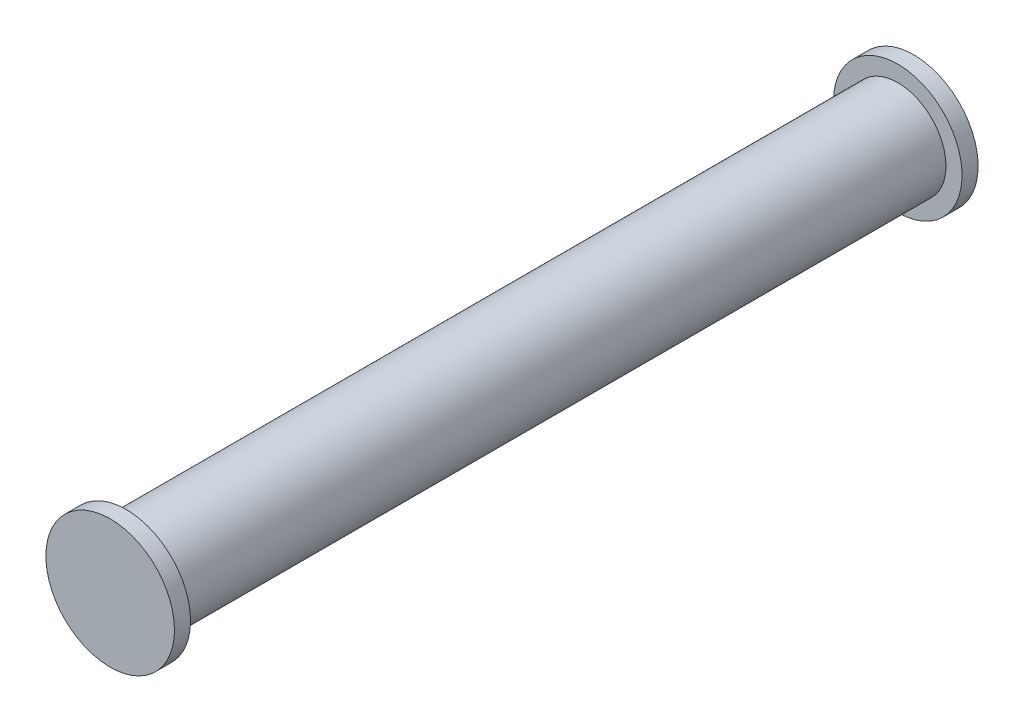
from build123d import *

# Parameters (mm, degrees)
SKETCH1_R           = 19.05
BOSS_EXTRUDE1_DEPTH = 304.8
SKETCH2_R           = 25.4
BOSS_EXTRUDE2_DEPTH = 6.35
BOSS_EXTRUDE3_START = 6.35
SKETCH3_R           = 25.4
BOSS_EXTRUDE3_DEPTH = 6.35


with BuildPart() as part:
    # Sketch1 → Boss-Extrude1 (new body)
    with BuildSketch(Plane.XY):
        with Locations(Location((0, 0, 0), (0, 0, 180))):
            Circle(SKETCH1_R)
    extrude(amount=BOSS_EXTRUDE1_DEPTH)

    # Sketch2 → Boss-Extrude2 (add)
    with BuildSketch(Plane.XY.offset(304.8)):
        Circle(SKETCH2_R)
    extrude(amount=BOSS_EXTRUDE2_DEPTH)

    # Sketch3 → Boss-Extrude3 (add)
    with BuildSketch(Plane(origin=(0, 0, 0), x_dir=(-1, 0, 0), z_dir=(0, 0, -1)).offset(BOSS_EXTRUDE3_START)):
        with Locations(Location((0, 0, 0), (0, 0, 180))):
            Circle(SKETCH3_R)
    extrude(amount=-BOSS_EXTRUDE3_DEPTH)


solid = part.part
